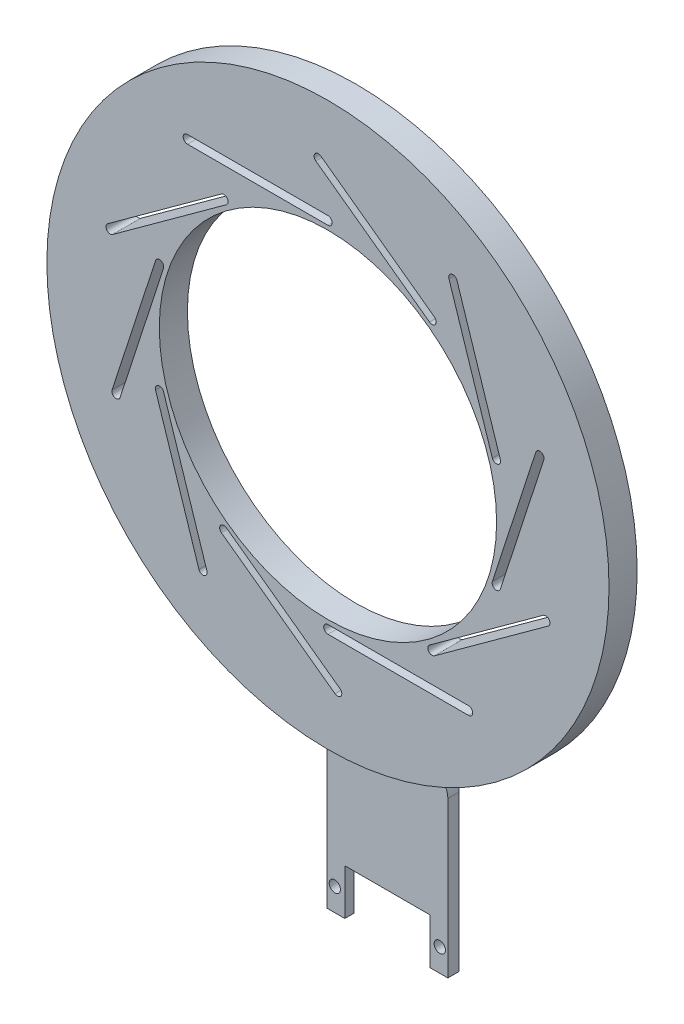
from build123d import *

# Parameters (mm, degrees)
SKETCH1_R           = 1000
SKETCH1_R_2         = 600
BOSS_EXTRUDE1_DEPTH = 100
ECHELLE1_SCALE      = 0.075
ESQUISSE1_R         = 1.5
BOSS_EXTRU_1_DEPTH  = 3
CONG_1_R            = 1
CONG_3_R            = 1
CHANFREIN1_SIZE     = 0.5


with BuildPart() as part:
    # Sketch1 → Boss-Extrude1 (new body)
    with BuildSketch(Plane.XY):
        Circle(SKETCH1_R)
        Circle(SKETCH1_R_2, mode=Mode.SUBTRACT)
        with BuildLine():
            Line((0, 615), (-500, 615))
            ThreePointArc((-500, 615), (-515, 630), (-500, 645))
            Line((-500, 645), (0, 645))
            ThreePointArc((0, 645), (15, 630), (0, 615))
        make_face(mode=Mode.SUBTRACT)
        with BuildLine():
            Line((361.48793016, 497.54545154), (-43.020567028, 791.438077687))
            ThreePointArc((-43.020567028, 791.438077687), (-46.339043159, 812.390111387), (-25.387009459, 815.708587518))
            Line((-25.387009459, 815.708587518), (379.121487729, 521.815961372))
            ThreePointArc((379.121487729, 521.815961372), (382.43996386, 500.863927672), (361.48793016, 497.54545154))
        make_face(mode=Mode.SUBTRACT)
        with BuildLine():
            Line((584.899757522, 190.04545154), (430.391260334, 665.573709688))
            ThreePointArc((430.391260334, 665.573709688), (440.021853163, 684.474812348), (458.922955823, 674.84421952))
            Line((458.922955823, 674.84421952), (613.43145301, 199.315961372))
            ThreePointArc((613.43145301, 199.315961372), (603.800860182, 180.414858712), (584.899757522, 190.04545154))
        make_face(mode=Mode.SUBTRACT)
        with BuildLine():
            Line((584.899757521, -190.045451541), (739.408254709, 285.482806607))
            ThreePointArc((739.408254709, 285.482806607), (758.309357369, 295.113399436), (767.939950198, 276.212296776))
            Line((767.939950198, 276.212296776), (613.43145301, -199.315961372))
            ThreePointArc((613.43145301, -199.315961372), (594.53035035, -208.946554201), (584.899757521, -190.045451541))
        make_face(mode=Mode.SUBTRACT)
        with BuildLine():
            Line((361.48793016, -497.545451541), (765.996427348, -203.652825394))
            ThreePointArc((765.996427348, -203.652825394), (786.948461048, -206.971301525), (783.629984916, -227.923335225))
            Line((783.629984916, -227.923335225), (379.121487729, -521.815961372))
            ThreePointArc((379.121487729, -521.815961372), (358.169454029, -518.497485241), (361.48793016, -497.545451541))
        make_face(mode=Mode.SUBTRACT)
        with BuildLine():
            Line((0, -615), (500, -615))
            ThreePointArc((500, -615), (515, -630), (500, -645))
            Line((500, -645), (0, -645))
            ThreePointArc((0, -645), (-15, -630), (0, -615))
        make_face(mode=Mode.SUBTRACT)
        with BuildLine():
            Line((-361.48793016, -497.54545154), (43.020567028, -791.438077687))
            ThreePointArc((43.020567028, -791.438077687), (46.339043159, -812.390111387), (25.387009459, -815.708587518))
            Line((25.387009459, -815.708587518), (-379.121487729, -521.815961372))
            ThreePointArc((-379.121487729, -521.815961372), (-382.43996386, -500.863927672), (-361.48793016, -497.54545154))
        make_face(mode=Mode.SUBTRACT)
        with BuildLine():
            Line((-584.899757522, -190.04545154), (-430.391260334, -665.573709688))
            ThreePointArc((-430.391260334, -665.573709688), (-440.021853163, -684.474812348), (-458.922955823, -674.84421952))
            Line((-458.922955823, -674.84421952), (-613.43145301, -199.315961372))
            ThreePointArc((-613.43145301, -199.315961372), (-603.800860182, -180.414858712), (-584.899757522, -190.04545154))
        make_face(mode=Mode.SUBTRACT)
        with BuildLine():
            Line((-584.899757521, 190.045451541), (-739.408254709, -285.482806607))
            ThreePointArc((-739.408254709, -285.482806607), (-758.309357369, -295.113399436), (-767.939950198, -276.212296776))
            Line((-767.939950198, -276.212296776), (-613.43145301, 199.315961372))
            ThreePointArc((-613.43145301, 199.315961372), (-594.53035035, 208.946554201), (-584.899757521, 190.045451541))
        make_face(mode=Mode.SUBTRACT)
        with BuildLine():
            Line((-361.48793016, 497.545451541), (-765.996427347, 203.652825394))
            ThreePointArc((-765.996427347, 203.652825394), (-786.948461048, 206.971301525), (-783.629984916, 227.923335225))
            Line((-783.629984916, 227.923335225), (-379.121487728, 521.815961372))
            ThreePointArc((-379.121487728, 521.815961372), (-358.169454028, 518.497485241), (-361.48793016, 497.545451541))
        make_face(mode=Mode.SUBTRACT)
    extrude(amount=BOSS_EXTRUDE1_DEPTH)


with BuildPart() as part_1:
    # Echelle1: scaled about (0, 0, 50)
    add(part.part.scale(ECHELLE1_SCALE).moved(Location((0, 0, 46.25))))

    # Esquisse1 → Boss.-Extru.1 (add)
    with BuildSketch(Plane(origin=(0, 0, 46.25), x_dir=(-1, 0, 0), z_dir=(0, 0, -1))):
        with BuildLine():
            Line((0.012013665, -104.11489824), (0.012013665, -116.31489824))
            Line((0.012013665, -116.31489824), (4.812013665, -116.31489824))
            Line((4.812013665, -116.31489824), (4.812013665, -74.845470968))
            ThreePointArc((4.812013665, -74.845470968), (-10.438835143, -74.26998533), (-25.257433458, -70.619133775))
            ThreePointArc((-25.257433458, -70.619133775), (-26.896134951, -72.45605199), (-27.487986335, -74.845470968))
            Line((-27.487986335, -74.845470968), (-27.487986335, -116.31489824))
            Line((-27.487986335, -116.31489824), (-22.687986335, -116.31489824))
            Line((-22.687986335, -116.31489824), (-22.687986335, -104.11489824))
            Line((-22.687986335, -104.11489824), (0.012013665, -104.11489824))
        make_face()
        with Locations((-25.337986335, -110.21489824)):
            Circle(ESQUISSE1_R, mode=Mode.SUBTRACT)
        with Locations((2.662013665, -110.21489824)):
            Circle(ESQUISSE1_R, mode=Mode.SUBTRACT)
    extrude(amount=-BOSS_EXTRU_1_DEPTH)

    # Congé1
    cong_1_edges = [part_1.edges().sort_by_distance(p)[0] for p in [
        (25.257433458, -70.619133775, 47.75),
    ]]
    fillet(cong_1_edges, radius=CONG_1_R)

    # Congé3
    cong_3_edges = [part_1.edges().sort_by_distance(p)[0] for p in [
        (-4.812013665, -74.845470968, 47.75),
    ]]
    fillet(cong_3_edges, radius=CONG_3_R)

    # Chanfrein1
    chanfrein1_edges = [part_1.edges().sort_by_distance(p)[0] for p in [
        (22.687986335, -110.21489824, 46.25),
        (11.337986335, -104.11489824, 46.25),
        (-0.012013665, -110.21489824, 46.25),
    ]]
    chamfer(chanfrein1_edges, length=CHANFREIN1_SIZE)


solid = part_1.part
